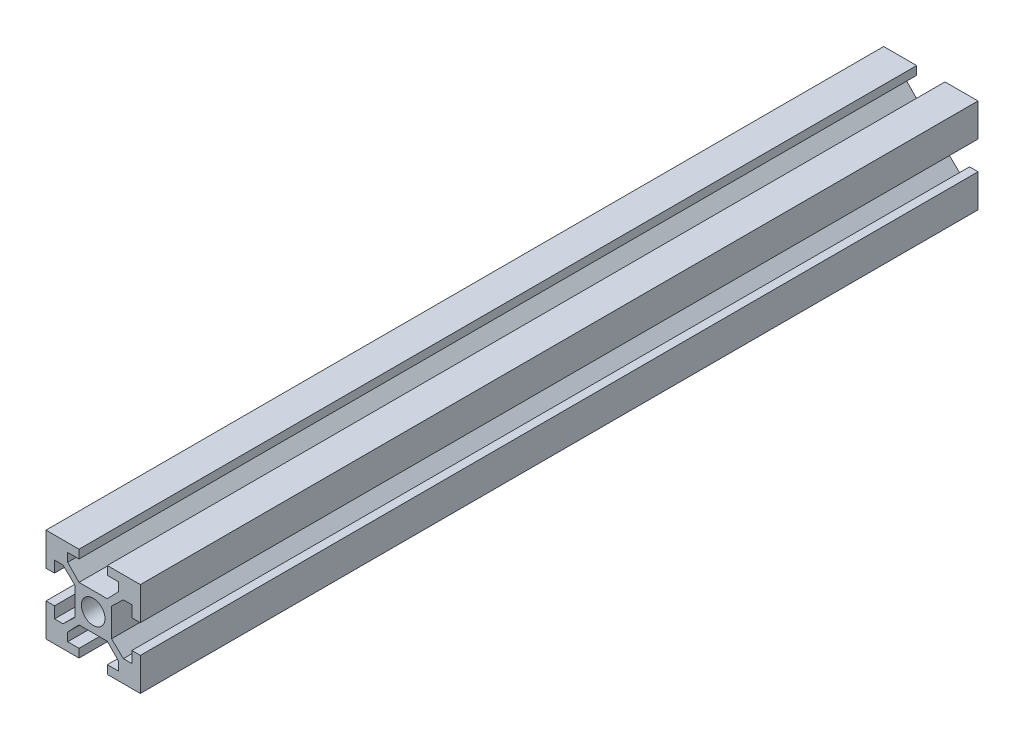
from build123d import *

# Parameters (mm, degrees)
SKETCH1_R           = 2.5
BOSS_EXTRUDE1_DEPTH = 177.6


with BuildPart() as part:
    # Sketch1 → Boss-Extrude1 (new body)
    with BuildSketch(Plane.XY):
        Polygon((7, -1.8), (7, 0), (0, 0), (0, -7), (0.4, -7), (1.8, -7), (1.8, -4.6), (2.2, -4.6), (3.6, -4.6), (6.1, -7), (6.1, -13), (3.6, -15.4), (1.8, -15.4), (1.8, -13), (0.4, -13), (0, -13), (0, -20), (7, -20), (7, -18.2), (4.6, -18.2), (4.6, -16.4), (7, -13.9), (7.016, -13.9), (13, -13.9), (15.4, -16.4), (15.4, -18.2), (13, -18.2), (13, -19.6), (13, -20), (20, -20), (20, -13), (18.2, -13), (18.2, -15), (18.2, -15.4), (16.4, -15.4), (13.9, -13), (13.9, -12.6), (13.9, -7), (16.4, -4.6), (18.2, -4.6), (18.2, -7), (20, -7), (20, -6.6), (20, 0), (13, 0), (13, -1.8), (15.4, -1.8), (15.4, -3.6), (13, -6.1), (7, -6.1), (4.6, -3.6), (4.6, -1.8), align=None)
        with Locations((10, -10)):
            Circle(SKETCH1_R, mode=Mode.SUBTRACT)
    extrude(amount=BOSS_EXTRUDE1_DEPTH)


solid = part.part
